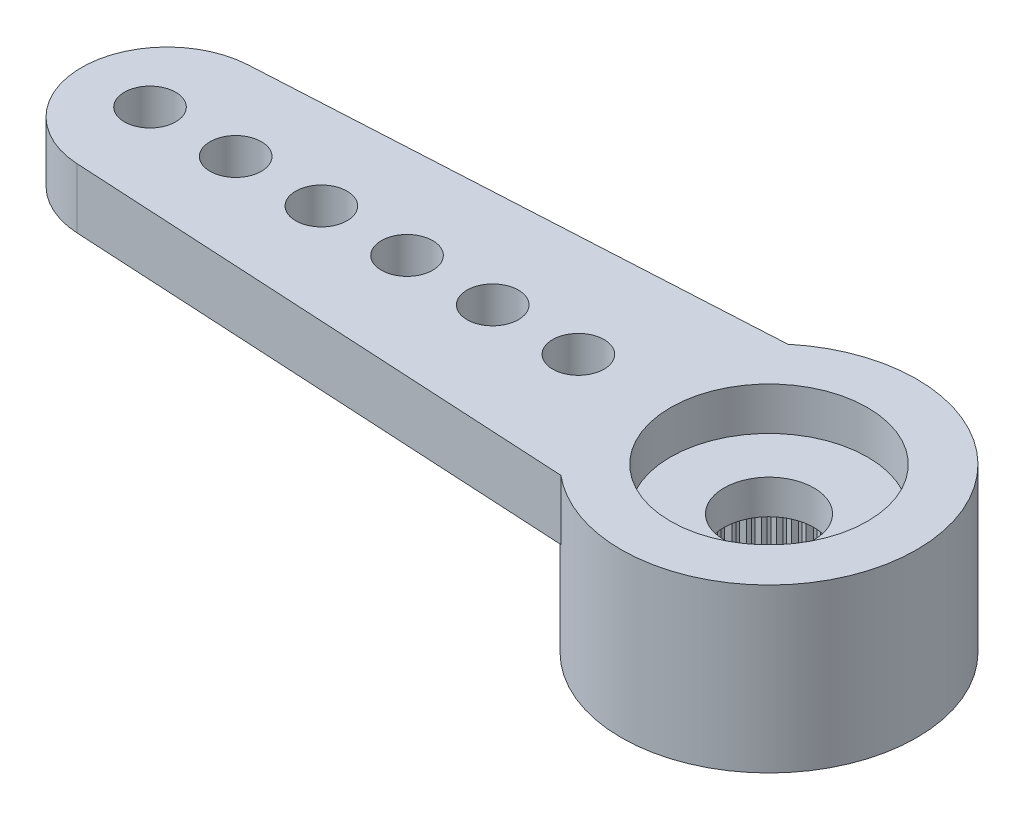
from build123d import *

# Parameters (mm, degrees)
RESSALTO_EXTRUS_O1_DEPTH = 1.4
ESBO_O2_R                = 3.45
RESSALTO_EXTRUS_O2_DEPTH = 2.4
FURO4_D                  = 1.2
PADR_O_LINEAR1_COUNT     = 6
PADR_O_LINEAR1_PITCH     = 2
FURO1_D                  = 4.95
FURO1_DEPTH              = 2
FURO2_D                  = 4.6
FURO2_DEPTH              = 1
FURO3_D                  = 2.1
RESSALTO_EXTRUS_O3_START = -2
RESSALTO_EXTRUS_O3_DEPTH = 2
PADR_OCIRCULAR1_COUNT    = 60


with BuildPart() as part:
    # Esboço1 → Ressalto-extrusão1 (new body)
    with BuildSketch(Plane(origin=(0, 0, 0), x_dir=(1, 0, 0), z_dir=(0, 1, 0))):
        with BuildLine():
            Line((-14.159121967, 1.99702088), (-2.209072203, 2.65))
            ThreePointArc((-2.209072203, 2.65), (3.45, 0), (-2.209072203, -2.65))
            Line((-2.209072203, -2.65), (-14.159121967, -1.99702088))
            ThreePointArc((-14.159121967, -1.99702088), (-16.05, 0), (-14.159121967, 1.99702088))
        make_face()
    extrude(amount=-RESSALTO_EXTRUS_O1_DEPTH)

    # Esboço2 → Ressalto-extrusão2 (add)
    with BuildSketch(Plane.XZ.offset(1.4)):
        with Locations(Location((0, 0, 0), (0, 0, 90))):
            Circle(ESBO_O2_R)
    extrude(amount=RESSALTO_EXTRUS_O2_DEPTH)

    # Furo4 (through all)
    with Locations(Plane(origin=(0, 0, 0), x_dir=(1, 0, 0), z_dir=(0, 1, 0))):
        with Locations((-14.45, 0)):
            furo4 = Hole(FURO4_D / 2)

    # Padrão linear1: Furo4 ×6
    with Locations(*[(i * PADR_O_LINEAR1_PITCH, 0, 0) for i in range(1, PADR_O_LINEAR1_COUNT)]):
        add(furo4, mode=Mode.SUBTRACT)

    # Furo1
    with Locations(Plane(origin=(0, -3.8, 0), x_dir=(-1, 0, 0), z_dir=(0, -1, 0))):
        with Locations((0, 0)):
            Hole(FURO1_D / 2, depth=FURO1_DEPTH)

    # Furo2
    with Locations(Plane(origin=(0, 0, 0), x_dir=(1, 0, 0), z_dir=(0, 1, 0))):
        with Locations((0, 0)):
            Hole(FURO2_D / 2, depth=FURO2_DEPTH)

    # Furo3 (through all)
    with Locations(Plane(origin=(0, 0, 0), x_dir=(1, 0, 0), z_dir=(0, 1, 0))):
        with Locations((0, 0)):
            Hole(FURO3_D / 2)

    # Esboço11 → Ressalto-extrusão3 (add)
    with BuildSketch(Plane.XZ.offset(3.8).offset(RESSALTO_EXTRUS_O3_START)):
        with BuildLine():
            Line((-0.098056786, 2.473056786), (0, 2.375))
            Line((0, 2.375), (0.098056786, 2.473056786))
            ThreePointArc((0.098056786, 2.473056786), (0, 2.475), (-0.098056786, 2.473056786))
        make_face()
    ressalto_extrus_o3 = extrude(amount=RESSALTO_EXTRUS_O3_DEPTH)

    # PadrãoCircular1: Ressalto-extrusão3 ×60 about axis
    padr_ocircular1_axis = Axis((0, 0, 0), (0, 1, 0))
    for i in range(1, PADR_OCIRCULAR1_COUNT):
        add(ressalto_extrus_o3.rotate(padr_ocircular1_axis, i * 360 / PADR_OCIRCULAR1_COUNT))


solid = part.part
